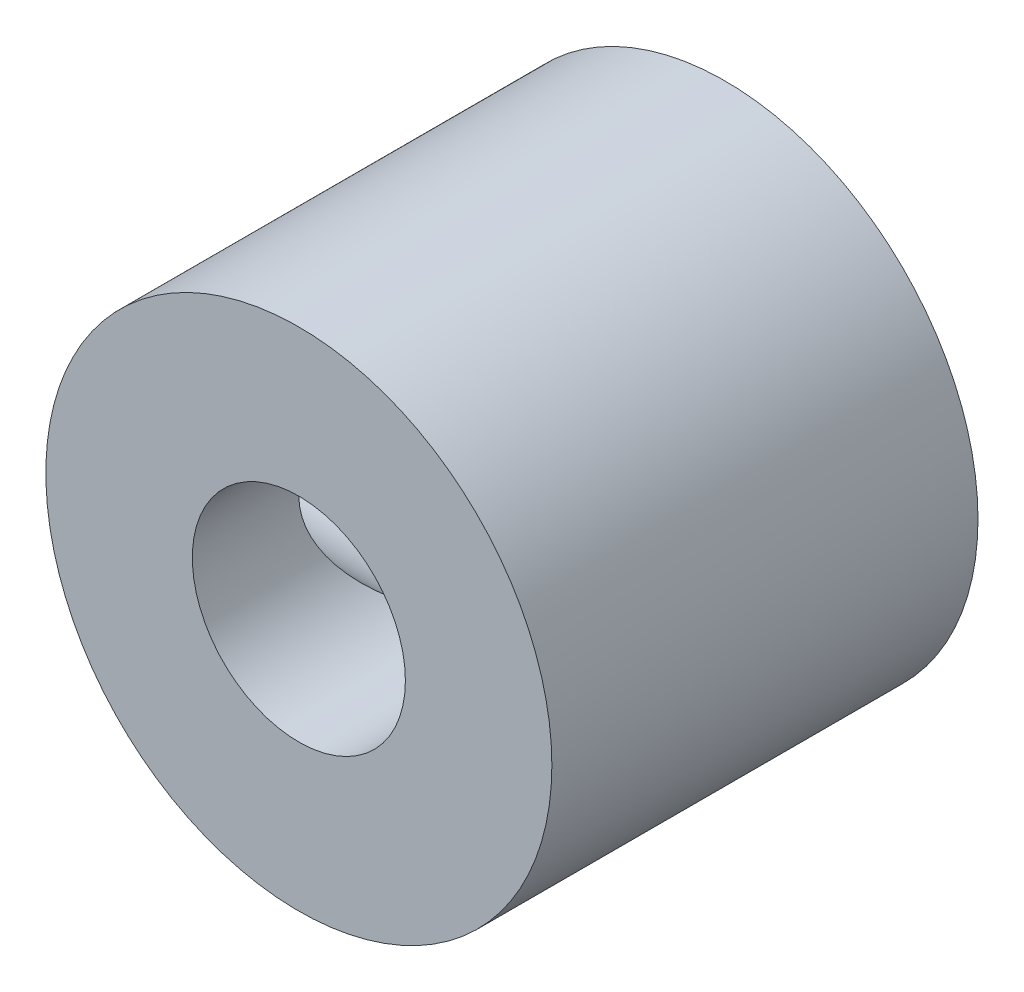
from build123d import *

# Parameters (mm, degrees)
SKETCH_1_R          = 4.75
SKETCH_1_R_2        = 2
EXTRUDE_1_DEPTH     = 8
SKETCH_2_R          = 2
CUT_EXTRUDE_1_DEPTH = 11.446291208


with BuildPart() as part:
    # 草图1 → 凸台-拉伸1 (new body)
    with BuildSketch(Plane.XY):
        Circle(SKETCH_1_R)
        Circle(SKETCH_1_R_2, mode=Mode.SUBTRACT)
    extrude(amount=EXTRUDE_1_DEPTH)

    # 草图2 → 切除-拉伸1 (cut, through all)
    with BuildSketch(Plane(origin=(0, 0, 0), x_dir=(0, 0, -1), z_dir=(1, 0, 0))):
        with Locations((-4, 0)):
            Circle(SKETCH_2_R)
    extrude(amount=-CUT_EXTRUDE_1_DEPTH, mode=Mode.SUBTRACT)


solid = part.part
